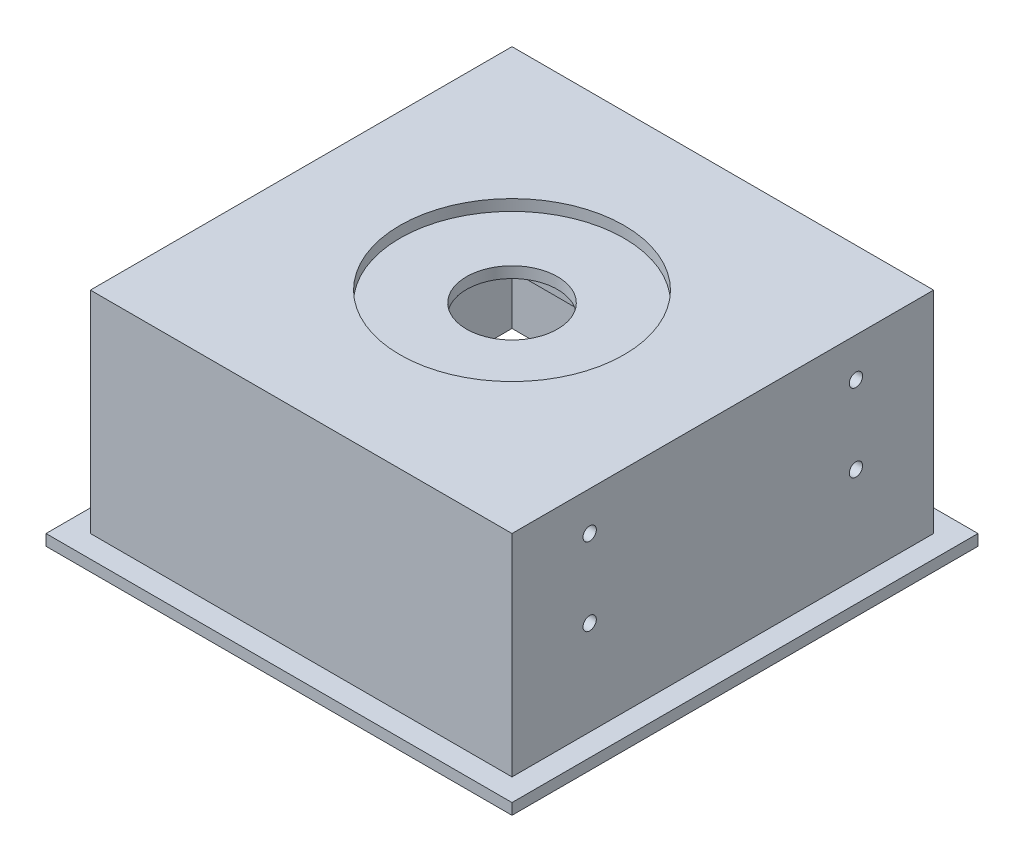
from build123d import *

# Parameters (mm, degrees)
SKETCH1_W           = 210
SKETCH1_H           = 210
BOSS_EXTRUDE1_DEPTH = 5
SKETCH2_W           = 190
SKETCH2_H           = 190
BOSS_EXTRUDE2_DEPTH = 95
SKETCH3_W           = 170
SKETCH3_H           = 170
CUT_EXTRUDE1_DEPTH  = 90
SKETCH4_R           = 50.5
CUT_EXTRUDE2_DEPTH  = 5
SKETCH5_R           = 20.5
CUT_EXTRUDE3_DEPTH  = 5
SKETCH6_W           = 60
SKETCH6_H           = 15
BOSS_EXTRUDE3_DEPTH = 12.5
SKETCH7_W           = 50
SKETCH7_H           = 7.5
CUT_EXTRUDE4_DEPTH  = 12.5
SKETCH8_R           = 2
CUT_EXTRUDE5_DEPTH  = 7.5
SKETCH9_R           = 3
CUT_EXTRUDE6_DEPTH  = 7.5


with BuildPart() as part:
    # Sketch1 → Boss-Extrude1 (new body)
    with BuildSketch(Plane(origin=(0, 0, 0), x_dir=(1, 0, 0), z_dir=(0, 1, 0))):
        with Locations((-105, 105)):
            Rectangle(SKETCH1_W, SKETCH1_H)
    extrude(amount=BOSS_EXTRUDE1_DEPTH)

    # Sketch2 → Boss-Extrude2 (add)
    with BuildSketch(Plane(origin=(0, 5, 0), x_dir=(1, 0, 0), z_dir=(0, 1, 0))):
        with Locations((-105, 105)):
            Rectangle(SKETCH2_W, SKETCH2_H)
    extrude(amount=BOSS_EXTRUDE2_DEPTH)

    # Sketch3 → Cut-Extrude1 (cut)
    with BuildSketch(Plane(origin=(0, 0, 0), x_dir=(-1, 0, 0), z_dir=(0, -1, 0))):
        with Locations((105, 105)):
            Rectangle(SKETCH3_W, SKETCH3_H)
    extrude(amount=-CUT_EXTRUDE1_DEPTH, mode=Mode.SUBTRACT)

    # Sketch4 → Cut-Extrude2 (cut)
    with BuildSketch(Plane(origin=(0, 100, 0), x_dir=(1, 0, 0), z_dir=(0, 1, 0))):
        with Locations(Location((-105, 105, 0), (0, 0, 270))):
            Circle(SKETCH4_R)
    extrude(amount=-CUT_EXTRUDE2_DEPTH, mode=Mode.SUBTRACT)

    # Sketch5 → Cut-Extrude3 (cut)
    with BuildSketch(Plane(origin=(0, 95, 0), x_dir=(1, 0, 0), z_dir=(0, 1, 0))):
        with Locations(Location((-105, 105, 0), (0, 0, 270))):
            Circle(SKETCH5_R)
    extrude(amount=-CUT_EXTRUDE3_DEPTH, mode=Mode.SUBTRACT)

    # Sketch6 → Boss-Extrude3 (add)
    with BuildSketch(Plane.XZ.offset(-90)):
        with Locations((-105, -87.5)):
            Rectangle(SKETCH6_W, SKETCH6_H)
        with Locations((-105, -142.5)):
            Rectangle(SKETCH6_W, SKETCH6_H)
    extrude(amount=BOSS_EXTRUDE3_DEPTH)

    # Sketch7 → Cut-Extrude4 (cut)
    with BuildSketch(Plane(origin=(0, 0, -95), x_dir=(-1, 0, 0), z_dir=(0, 0, -1))):
        with Locations((105, 86.25)):
            Rectangle(SKETCH7_W, SKETCH7_H)
    extrude(amount=-CUT_EXTRUDE4_DEPTH, mode=Mode.SUBTRACT)

    # Sketch8 → Cut-Extrude5 (cut)
    with BuildSketch(Plane.XZ.offset(-77.5)):
        with Locations(Location((-100, -89.8, 0), (0, 0, 270))):
            Circle(SKETCH8_R)
        with Locations(Location((-110, -89.8, 0), (0, 0, 270))):
            Circle(SKETCH8_R)
        with Locations(Location((-110, -140.2, 0), (0, 0, 270))):
            Circle(SKETCH8_R)
        with Locations(Location((-100, -140.2, 0), (0, 0, 270))):
            Circle(SKETCH8_R)
    extrude(amount=-CUT_EXTRUDE5_DEPTH, mode=Mode.SUBTRACT)

    # Sketch9 → Cut-Extrude6 (cut)
    with BuildSketch(Plane(origin=(-10, 0, 0), x_dir=(0, 0, -1), z_dir=(1, 0, 0))):
        with Locations((165, 47.5)):
            Circle(SKETCH9_R)
        with Locations((45, 47.5)):
            Circle(SKETCH9_R)
        with Locations((45, 82.5)):
            Circle(SKETCH9_R)
        with Locations((165, 82.5)):
            Circle(SKETCH9_R)
    extrude(amount=-CUT_EXTRUDE6_DEPTH, mode=Mode.SUBTRACT)


solid = part.part
